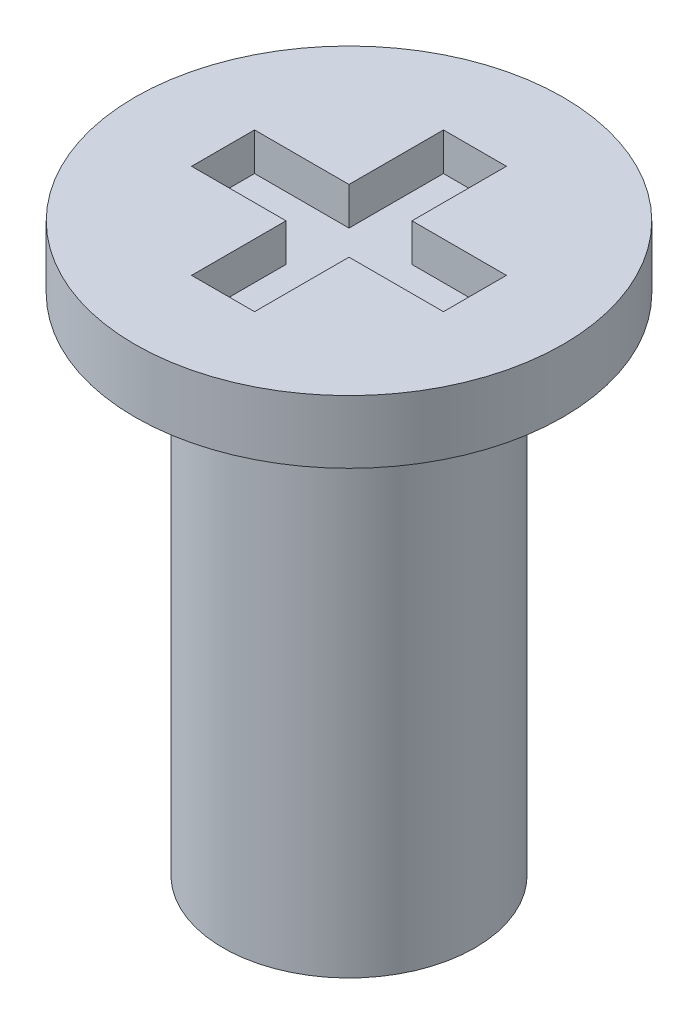
from build123d import *

# Parameters (mm, degrees)
SKETCH_2_W               = 0.5
SKETCH_2_H               = 1
CUT_EXTRUDE_1_DEPTH      = 0.3
PATTERN_CIRCULAR_1_COUNT = 4


with BuildPart() as part:
    # ｽｹｯﾁ1 → 回転1 (revolve)
    with BuildSketch(Plane.XY):
        Polygon((0, 0), (1.7, 0), (1.7, -0.5), (1, -0.5), (1, -4.5), (0, -4.5), align=None)
    revolve(axis=Axis((0, -4.5, 0), (0, 1, 0)))

    # ｽｹｯﾁ2 → ｶｯﾄ - 押し出し1 (cut)
    with BuildSketch(Plane(origin=(0, 0, 0), x_dir=(1, 0, 0), z_dir=(0, 1, 0))):
        with Locations((0, 0.5)):
            Rectangle(SKETCH_2_W, SKETCH_2_H)
    cut_extrude_1 = extrude(amount=-CUT_EXTRUDE_1_DEPTH, mode=Mode.SUBTRACT)

    # 円形ﾊﾟﾀｰﾝ1: ｶｯﾄ - 押し出し1 ×4 about axis
    pattern_circular_1_axis = Axis((0, 0, 0), (0, 1, 0))
    for i in range(1, PATTERN_CIRCULAR_1_COUNT):
        add(cut_extrude_1.rotate(pattern_circular_1_axis, i * 360 / PATTERN_CIRCULAR_1_COUNT), mode=Mode.SUBTRACT)


solid = part.part
